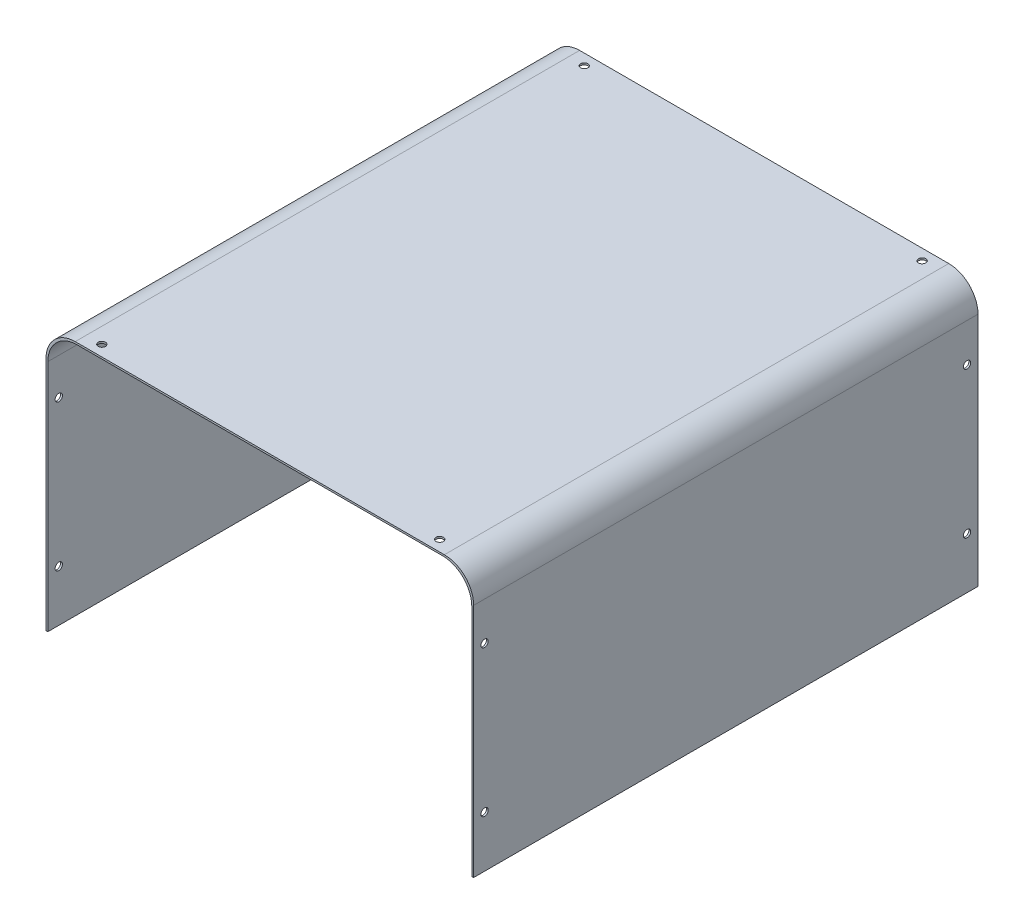
from build123d import *

# Parameters (mm, degrees)
SKETCH_1_W          = 117
SKETCH_1_H          = 138
EXTRUDE_1_DEPTH     = 72.5
CUT_EXTRUDE_1_DEPTH = 140
CUT_EXTRUDE_2_DEPTH = 140
SKETCH_6_R          = 1
CUT_EXTRUDE_5_DEPTH = 140
SKETCH_7_R          = 1
CUT_EXTRUDE_7_DEPTH = 140


with BuildPart() as part:
    # Эскиз1 → Бобышка-Вытянуть1 (new body)
    with BuildSketch(Plane(origin=(0, 0, 0), x_dir=(1, 0, 0), z_dir=(0, 1, 0))):
        with Locations((33.234281685, -3.234040823)):
            Rectangle(SKETCH_1_W, SKETCH_1_H)
    extrude(amount=EXTRUDE_1_DEPTH)

    # Эскиз2 → Вырез-Вытянуть1 (cut)
    with BuildSketch(Plane(origin=(0, 0, -65.765959177), x_dir=(-1, 0, 0), z_dir=(0, 0, -1))):
        with BuildLine():
            Line((-91.734281685, 64.5), (-91.734281685, 72.5))
            Line((-91.734281685, 72.5), (-83.734281685, 72.5))
            ThreePointArc((-83.734281685, 72.5), (-89.391135935, 70.156854249), (-91.734281685, 64.5))
        make_face()
        with BuildLine():
            Line((17.265718315, 72.5), (25.265718315, 72.5))
            Line((25.265718315, 72.5), (25.265718315, 64.5))
            ThreePointArc((25.265718315, 64.5), (22.922572564, 70.156854249), (17.265718315, 72.5))
        make_face()
    extrude(amount=-CUT_EXTRUDE_1_DEPTH, mode=Mode.SUBTRACT)

    # Эскиз3 → Вырез-Вытянуть2 (cut)
    with BuildSketch(Plane.XY.offset(72.234040823)):
        with BuildLine():
            Line((-24.765718315, 0), (91.234281685, 0))
            Line((91.234281685, 0), (91.234281685, 64))
            ThreePointArc((91.234281685, 64), (88.891135935, 69.656854249), (83.234281685, 72))
            Line((83.234281685, 72), (-16.765718315, 72))
            ThreePointArc((-16.765718315, 72), (-22.422572564, 69.656854249), (-24.765718315, 64))
            Line((-24.765718315, 64), (-24.765718315, 0))
        make_face()
    extrude(amount=-CUT_EXTRUDE_2_DEPTH, mode=Mode.SUBTRACT)

    # Эскиз6 → Вырез-Вытянуть5 (cut)
    with BuildSketch(Plane.ZY.offset(25.265718315)):
        with Locations((-62.765959177, 14)):
            Circle(SKETCH_6_R)
        with Locations(Location((69.234040823, 14, 0), (0, 0, 270))):
            Circle(SKETCH_6_R)
        with Locations((-62.765959177, 54)):
            Circle(SKETCH_6_R)
        with Locations(Location((69.234040823, 54, 0), (0, 0, 270))):
            Circle(SKETCH_6_R)
    extrude(amount=-CUT_EXTRUDE_5_DEPTH, mode=Mode.SUBTRACT)

    # Эскиз7 → Вырез-Вытянуть7 (cut)
    with BuildSketch(Plane(origin=(0, 72, 0), x_dir=(-1, 0, 0), z_dir=(0, -1, 0))):
        with Locations(Location((-79.454291209, 62.765959177, 0), (0, 0, 90))):
            Circle(SKETCH_7_R)
        with Locations((-582.904668668, 16.142688411)):
            Circle(SKETCH_7_R)
        with Locations(Location((12.9857274, -69.234040823, 0), (0, 0, 90))):
            Circle(SKETCH_7_R)
        with Locations(Location((-79.454291209, -69.234040823, 0), (0, 0, 90))):
            Circle(SKETCH_7_R)
        with Locations(Location((12.985727838, 62.765959177, 0), (0, 0, 90))):
            Circle(SKETCH_7_R)
    extrude(amount=-CUT_EXTRUDE_7_DEPTH, mode=Mode.SUBTRACT)


solid = part.part
